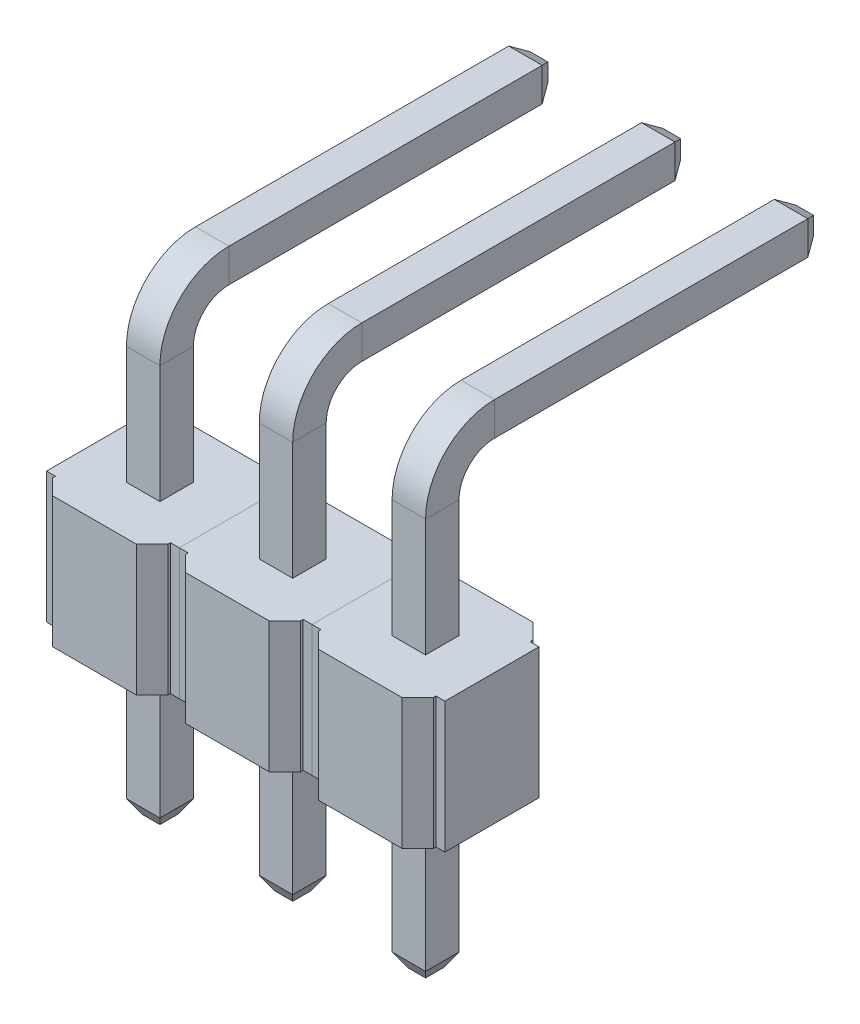
from build123d import *
from OCP.BRepFilletAPI import BRepFilletAPI_MakeChamfer

# Parameters (mm, degrees)
SKETCH_3_W             = 0.64
SKETCH_3_H             = 0.64
CHAMFER_1_SIZE         = 0.15
CHAMFER_1_SIZE2        = 0.259807621
EXTRUDE_1_DEPTH        = 2.5
CHAMFER_2_SIZE         = 0.3
PATTERN_LINEAR_1_COUNT = 3
PATTERN_LINEAR_1_PITCH = 2.54


with BuildPart() as part:
    # По траектории1: sweep along a path in Эскиз2
    with BuildLine(Plane(origin=(0, 0, 0), x_dir=(0, 0, -1), z_dir=(1, 0, 0))) as sweep_1_path:
        Line((0, -3), (0, 0))
        Line((0, 0), (0, 4.75))
        ThreePointArc((0, 4.75), (0.292893219, 5.457106781), (1, 5.75))
        Line((1, 5.75), (7.25, 5.75))
    # Эскиз3 → По траектории1 (sweep)
    with BuildSketch(Plane(origin=(0, 0, 0), x_dir=(1, 0, 0), z_dir=(0, 1, 0))):
        Rectangle(SKETCH_3_W, SKETCH_3_H)
    sweep(path=sweep_1_path.line)

    # Фаска1: one chamfer whose edges measure the first distance from different faces: ONE call of the kernel's chamfer builder (chamfer() names one face for all edges)
    chamfer_1_edges_1 = [part.edges().sort_by_distance(p)[0] for p in [
        (0, 5.43, -7.25),
        (-0.32, 5.75, -7.25),
        (0, 6.07, -7.25),
        (0.32, 5.75, -7.25),
    ]]
    chamfer_1_side_1 = [part.faces().sort_by_distance(p)[0] for p in [
        (0, 5.75, -7.25),
    ]]
    chamfer_1_edges_2 = [part.edges().sort_by_distance(p)[0] for p in [
        (0.32, -3, 0),
        (0, -3, -0.32),
        (-0.32, -3, 0),
        (0, -3, 0.32),
    ]]
    chamfer_1_side_2 = [part.faces().sort_by_distance(p)[0] for p in [
        (0, -3, 0),
    ]]
    chamfer_1 = BRepFilletAPI_MakeChamfer(part.part.solid().wrapped)
    for e in chamfer_1_edges_1:
        chamfer_1.Add(CHAMFER_1_SIZE, CHAMFER_1_SIZE2, e.wrapped, chamfer_1_side_1[0].wrapped)  # the first distance lies on this face
    for e in chamfer_1_edges_2:
        chamfer_1.Add(CHAMFER_1_SIZE, CHAMFER_1_SIZE2, e.wrapped, chamfer_1_side_2[0].wrapped)  # the first distance lies on this face
    add(Compound.cast(chamfer_1.Shape()), mode=Mode.REPLACE)


with BuildPart() as body_2:
    # Эскиз4 → Бобышка-Вытянуть1 (new body)
    with BuildSketch(Plane(origin=(0, 0, 0), x_dir=(1, 0, 0), z_dir=(0, 1, 0))):
        Polygon((-1.1, 0.9), (-1.1, 1.25), (1.1, 1.25), (1.1, 0.9), (1.27, 0.9), (1.27, -0.9), (1.1, -0.9), (1.1, -1.25), (-1.1, -1.25), (-1.1, -0.9), (-1.27, -0.9), (-1.27, 0.9), align=None)
    extrude(amount=EXTRUDE_1_DEPTH)

    # Фаска2
    chamfer_2_edges = [body_2.edges().sort_by_distance(p)[0] for p in [
        (1.1, 1.25, 1.25),
        (-1.1, 1.25, 1.25),
        (-1.1, 1.25, -1.25),
        (1.1, 1.25, -1.25),
    ]]
    chamfer(chamfer_2_edges, length=CHAMFER_2_SIZE)


with BuildPart() as pattern_linear_1_1:
    # Линейный массив1: pattern copy
    add(part.part.moved(Location(Vector(-1, 0, 0) * (1 * PATTERN_LINEAR_1_PITCH))))


with BuildPart() as pattern_linear_1_2:
    # Линейный массив1: pattern copy
    add(part.part.moved(Location(Vector(-1, 0, 0) * (2 * PATTERN_LINEAR_1_PITCH))))


with BuildPart() as pattern_linear_1_3:
    # Линейный массив1: pattern copy
    add(body_2.part.moved(Location(Vector(-1, 0, 0) * (1 * PATTERN_LINEAR_1_PITCH))))


with BuildPart() as pattern_linear_1_4:
    # Линейный массив1: pattern copy
    add(body_2.part.moved(Location(Vector(-1, 0, 0) * (2 * PATTERN_LINEAR_1_PITCH))))


solid = Compound([part.part, body_2.part, pattern_linear_1_1.part, pattern_linear_1_2.part, pattern_linear_1_3.part, pattern_linear_1_4.part])
